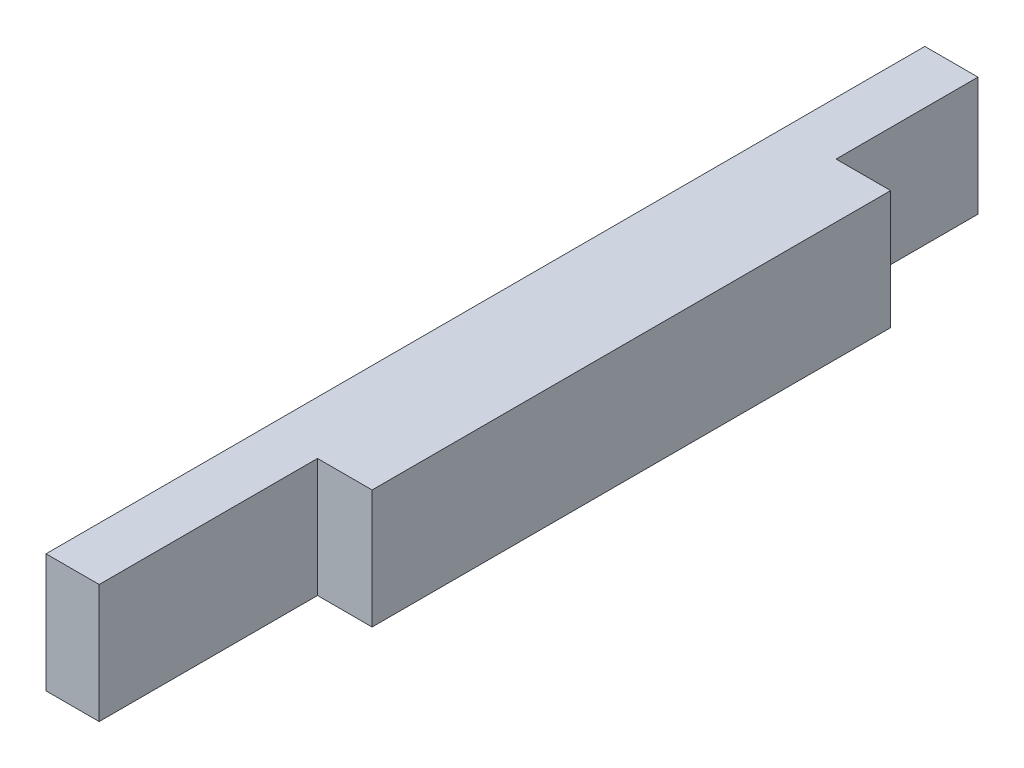
from build123d import *

# Parameters (mm, degrees)
BOSS_EXTRUDE1_DEPTH = 11.05


with BuildPart() as part:
    # Sketch2 → Boss-Extrude1 (new body)
    with BuildSketch(Plane(origin=(0, 0, 0), x_dir=(1, 0, 0), z_dir=(0, 1, 0))):
        Polygon((0, 0), (4.95, 0), (4.95, 20.32), (10.03, 20.32), (10.03, 68.58), (4.95, 68.58), (4.95, 81.79), (0, 81.79), align=None)
    extrude(amount=BOSS_EXTRUDE1_DEPTH)


solid = part.part
